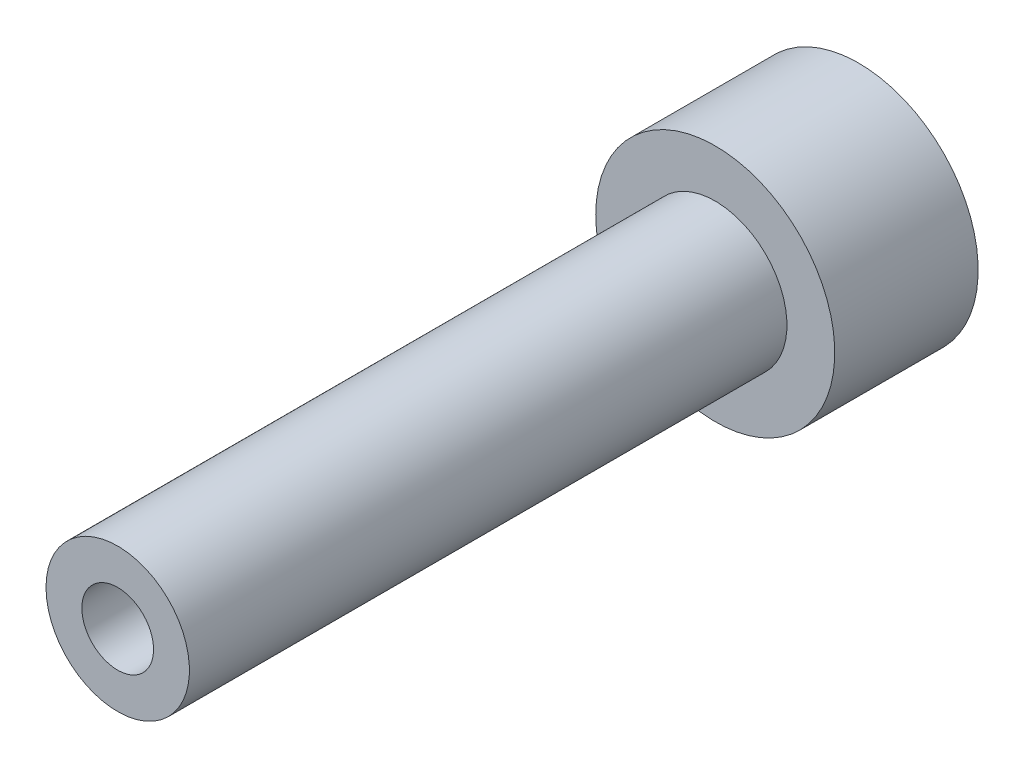
from build123d import *


with BuildPart() as part:
    # Sketch1 → Revolve1 (revolve)
    with BuildSketch(Plane(origin=(0, 0, 0), x_dir=(0, 0, -1), z_dir=(1, 0, 0)), mode=Mode.PRIVATE) as revolve1_sk:
        Polygon((0, 0.85), (0, 2.5), (-3, 2.5), (-3, 1.5), (-15.5, 1.5), (-15.5, 0.75), (-2, 0.75), (-2, 0.85), align=None)
    revolve(revolve1_sk.sketch.rotate(Axis((0, 0, 0), (0, 0, 1)), 90), axis=Axis((0, 0, 0), (0, 0, 1)))


solid = part.part
